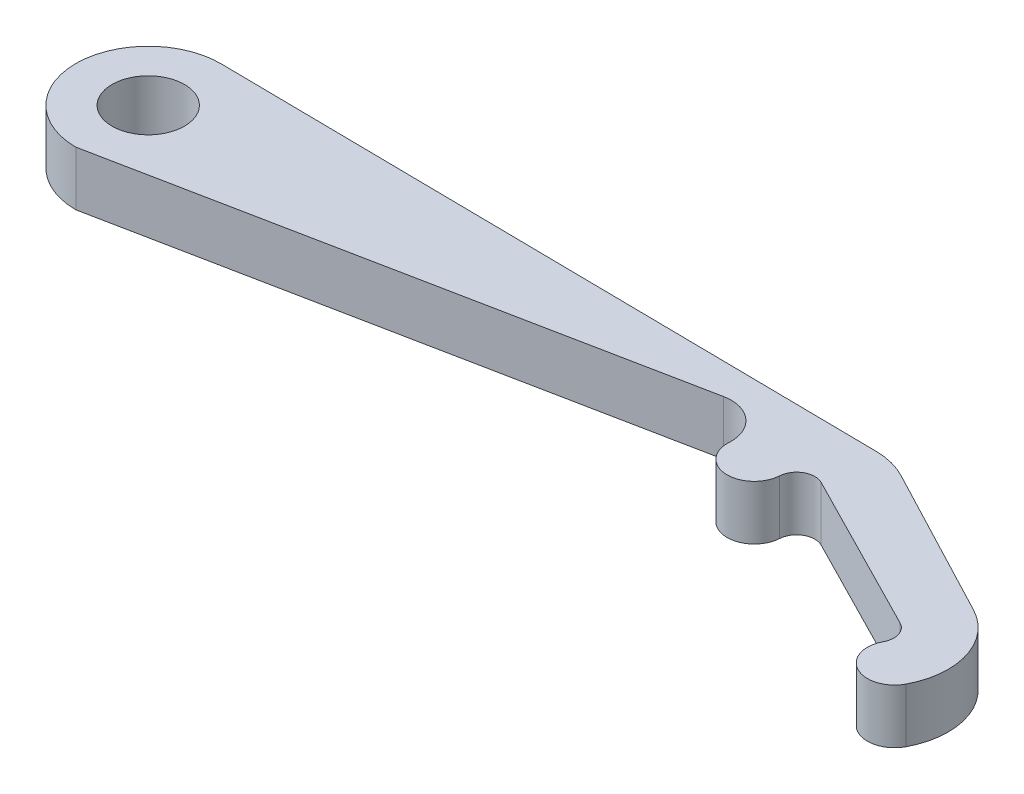
from build123d import *

# Parameters (mm, degrees)
SKETCH1_R           = 2
BOSS_EXTRUDE1_DEPTH = 3


with BuildPart() as part:
    # Sketch1 → Boss-Extrude1 (new body)
    with BuildSketch(Plane(origin=(0, 0, 0), x_dir=(-1, 0, 0), z_dir=(0, 1, 0))):
        with BuildLine():
            Line((-13.023955953, -3.551475079), (23.596044053, -3.999700403))
            ThreePointArc((23.596044053, -3.999700403), (27.6449251, -0.024478432), (23.645, 4))
            Line((23.645, 4), (-6.179618863, -1.958864922))
            ThreePointArc((-6.179618863, -1.958864922), (-7.859851478, -1.510674898), (-8.52802301, 0.094816535))
            ThreePointArc((-8.52802301, 0.094816535), (-9.929506285, 1.686957231), (-11.521937407, 0.285803961))
            ThreePointArc((-11.521937407, 0.285803961), (-12.027681304, -0.523458534), (-12.981727074, -0.545352487))
            Line((-12.981727074, -0.545352487), (-21.889675517, 3.998669315))
            ThreePointArc((-21.889675517, 3.998669315), (-22.389088805, 4.58847924), (-22.319318125, 5.358168419))
            ThreePointArc((-22.319318125, 5.358168419), (-22.943168419, 7.385681875), (-24.970681875, 6.761831581))
            ThreePointArc((-24.970681875, 6.761831581), (-25.256630844, 3.706810464), (-23.29448222, 1.347807789))
            Line((-23.29448222, 1.347807789), (-14.834203373, -3.093435701))
            ThreePointArc((-14.834203373, -3.093435701), (-13.956181951, -3.429568117), (-13.023955953, -3.551475079))
        make_face()
        with Locations(Location((23.645, 0, 0), (0, 0, 90))):
            Circle(SKETCH1_R, mode=Mode.SUBTRACT)
    extrude(amount=BOSS_EXTRUDE1_DEPTH)


solid = part.part
